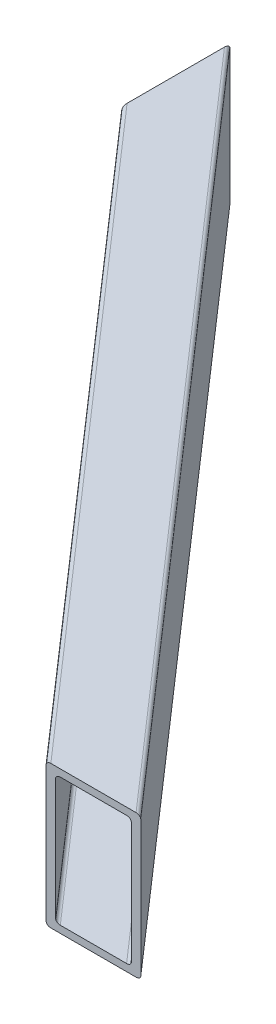
from build123d import *

# Parameters (mm, degrees)
BOSS_EXTRU_1_DEPTH           = 80
COQUE1_T                     = 4
ENL_V_MAT_EXTRU_1_DEPTH      = 596.562293525
ENL_V_MAT_EXTRU_1_DEPTH_BACK = 596.562293525
ESQUISSE2_W                  = 72
ESQUISSE2_H                  = 32
CONG_1_R                     = 2


with BuildPart() as part:
    # Esquisse1 → Boss.-Extru.1 (new body)
    with BuildSketch(Plane(origin=(0, 0, 0), x_dir=(1, 0, 0), z_dir=(0, 1, 0))):
        Polygon((0, 339.256309642), (296.849270936, 0), (350, 0), (0, 400), align=None)
    extrude(amount=BOSS_EXTRU_1_DEPTH)

    # Coque1 (no face opened: a closed hollow body)
    add(offset(amount=-COQUE1_T, mode=Mode.PRIVATE), mode=Mode.SUBTRACT)

    # Esquisse2 → Enlèv. mat.-Extru.1 (cut, two sides: drawn at the far end of the back side and taken through both)
    with BuildSketch(Plane(origin=(128.722250229, 0, 147.111143119), x_dir=(0, -1, 0), z_dir=(-0.6585046078685182, 0, -0.7525766947068777)).offset(-ENL_V_MAT_EXTRU_1_DEPTH_BACK)):
        with Locations((-40, -243.401843147)):
            Rectangle(ESQUISSE2_W, ESQUISSE2_H)
    extrude(amount=ENL_V_MAT_EXTRU_1_DEPTH + ENL_V_MAT_EXTRU_1_DEPTH_BACK, mode=Mode.SUBTRACT)

    # Congé1
    cong_1_edges = [part.edges().sort_by_distance(p)[0] for p in [
        (175, 80, -200),
        (151.082171921, 4, -172.665339339),
        (172.342463547, 4, -196.962815482),
        (151.082171921, 76, -172.665339339),
        (172.342463547, 76, -196.962815482),
        (175, 0, -200),
        (148.424635468, 0, -169.628154821),
        (148.424635468, 80, -169.628154821),
    ]]
    fillet(cong_1_edges, radius=CONG_1_R)


solid = part.part
